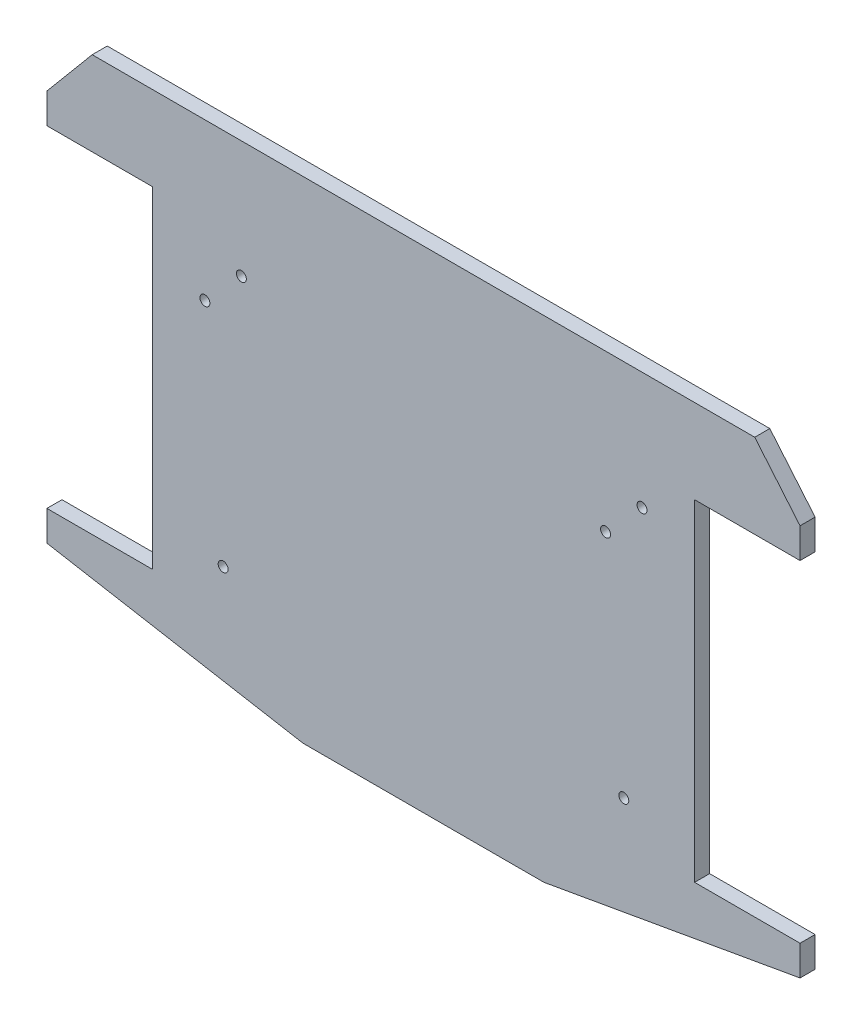
from build123d import *

# Parameters (mm, degrees)
EXTRUDE_2_DEPTH     = 5
SKETCH_3_R          = 1.65
CUT_EXTRUDE_1_DEPTH = 10


with BuildPart() as part:
    # Эскиз1 → Бобышка-Вытянуть2 (new body)
    with BuildSketch(Plane(origin=(139.725199601, 79.945164962, 32.467820781), x_dir=(-1, 0, 0), z_dir=(0, 0, -1))):
        Polygon((-54.33719348, 85.310831528), (-54.33719348, 195.310831528), (-19.33719348, 195.310831528), (-19.33719348, 205.310831528), (-34.368760963, 223.252548998), (-254.305625996, 223.252548998), (-269.33719348, 205.310831528), (-269.33719348, 195.310831528), (-234.33719348, 195.310831528), (-234.33719348, 85.310831528), (-269.33719348, 85.310831528), (-269.33719348, 75.310831528), (-184.33719348, 60.310831528), (-104.33719348, 60.310831528), (-19.33719348, 75.310831528), (-19.33719348, 85.310831528), align=None)
    extrude(amount=EXTRUDE_2_DEPTH)

    # Эскиз3 → Вырез-Вытянуть1 (cut)
    with BuildSketch(Plane(origin=(0, 0, 27.467820781), x_dir=(-1, 0, 0), z_dir=(0, 0, -1))):
        with Locations((-217.562393081, 177.75599649)):
            Circle(SKETCH_3_R)
        with Locations((-350.562393081, 177.75599649)):
            Circle(SKETCH_3_R)
        with Locations((-356.614117219, 264.25599649)):
            Circle(SKETCH_3_R)
        with Locations((-344.510668943, 251.25599649)):
            Circle(SKETCH_3_R)
        with Locations((-211.510668943, 251.25599649)):
            Circle(SKETCH_3_R)
        with Locations((-223.614117219, 264.25599649)):
            Circle(SKETCH_3_R)
    extrude(amount=-CUT_EXTRUDE_1_DEPTH, mode=Mode.SUBTRACT)


solid = part.part
